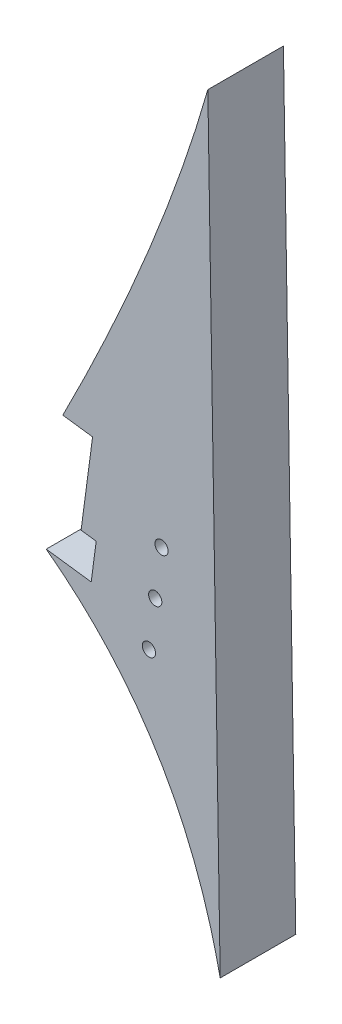
from build123d import *

# Parameters (mm, degrees)
BOSS_EXTRUDE1_DEPTH = 20
SKETCH2_R           = 1.75
CUT_EXTRUDE1_DEPTH  = 613.992726316


with BuildPart() as part:
    # Sketch1 → Boss-Extrude1 (new body)
    with BuildSketch(Plane.XY):
        with BuildLine():
            Line((273.434767303, -422.936084161), (270.394702546, -445.835167249))
            Line((270.394702546, -445.835167249), (274.394702546, -446.36620419))
            Line((274.394702546, -446.36620419), (273.067110194, -456.36620419))
            Line((273.067110194, -456.36620419), (261.171482616, -454.78694977))
            add(Edge.make_bspline(
                [(261.171482616, -454.78694977), (296.963881998, -481.467411972), (307.211379584, -530.076645967)],
                knots=[0, 0, 0, 1, 1, 1], degree=2))
            Line((307.211379584, -530.076645967), (306.527614225, -487.761523765))
            Line((306.527614225, -487.761523765), (304.794080931, -380.481047826))
            Line((304.794080931, -380.481047826), (303.947271008, -328.075840548))
            add(Edge.make_bspline(
                [(303.947271008, -328.075840548), (291.93823329, -370.199418032), (265.55288805, -421.8896919)],
                knots=[0, 0, 0, 1, 1, 1], degree=2))
            Line((265.55288805, -421.8896919), (273.434767303, -422.936084161))
        make_face()
    extrude(amount=BOSS_EXTRUDE1_DEPTH)

    # Sketch2 → Cut-Extrude1 (cut, through all)
    with BuildSketch(Plane.XY.offset(20)):
        with Locations((288.352935212, -464.179893051)):
            Circle(SKETCH2_R)
        with Locations((290.016681941, -451.647832837)):
            Circle(SKETCH2_R)
        with Locations((291.68042867, -439.115772622)):
            Circle(SKETCH2_R)
    extrude(amount=-CUT_EXTRUDE1_DEPTH, mode=Mode.SUBTRACT)


solid = part.part
